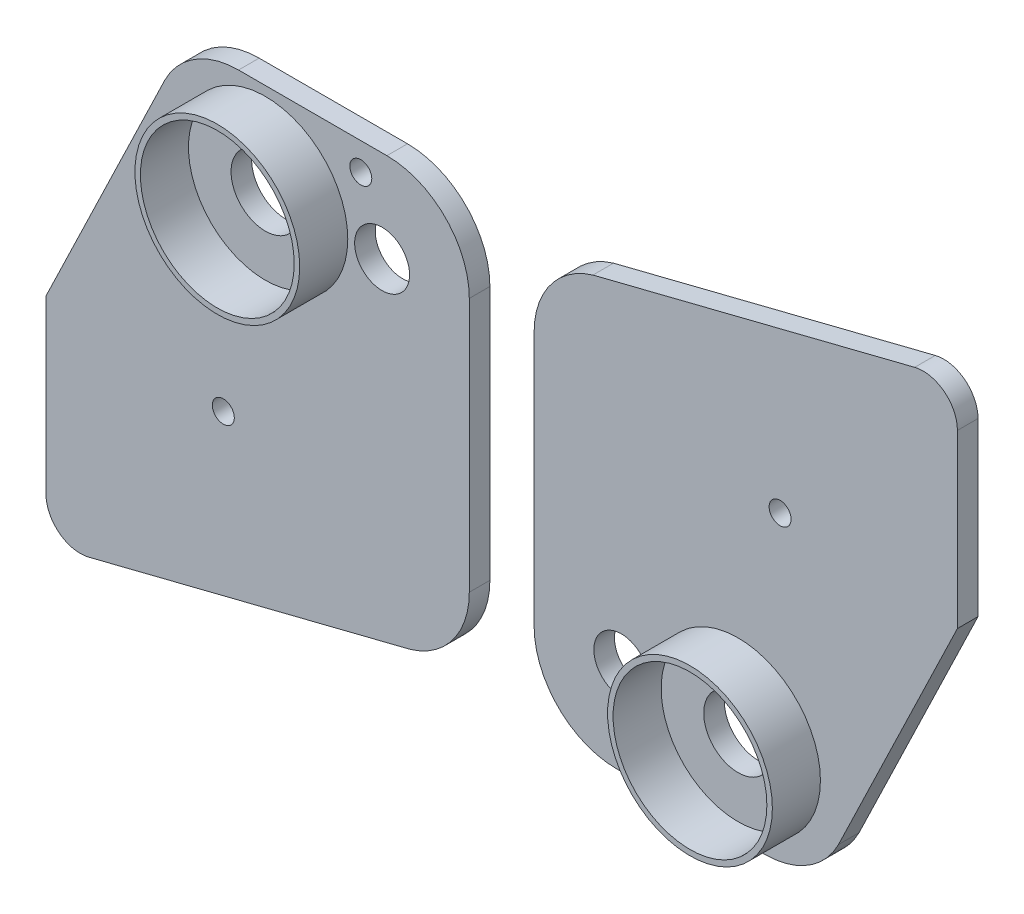
from build123d import *

# Parameters (mm, degrees)
MODEL_R                       = 5
MODEL_R_2                     = 4
MODEL_R_3                     = 1.6
Y_KSEKLIK_EKSTR_ZYON2_DEPTH   = 3
Y_KSEKLIK_EKSTR_ZYON2_2_DEPTH = 3
IZIM2_R                       = 12
IZIM2_R_2                     = 11.2
Y_KSEKLIK_EKSTR_ZYON3_DEPTH   = 7
IZIM3_R                       = 1.6
KES_EKSTR_ZYON1_DEPTH         = 7


with BuildPart() as part:
    # Model → Yükseklik-Ekstrüzyon2 (new body)
    with BuildSketch(Plane.XY):
        with BuildLine():
            Line((294.652901745, 168.135808825), (294.652403018, 143.145355564))
            ThreePointArc((294.652403018, 143.145355564), (296.578324113, 139.201902019), (300.872515341, 138.296407884))
            Line((300.872515341, 138.296407884), (347.73731009, 150.088964557))
            ThreePointArc((347.73731009, 150.088964557), (353.925243575, 154.418161808), (356.30167976, 161.586496391))
            Line((356.30167976, 161.586496391), (356.30175763, 168.122816561))
            Line((356.30175763, 168.122816561), (356.302119744, 198.648056356))
            ThreePointArc((356.302119744, 198.648056356), (352.78750447, 207.133373479), (344.302270705, 210.648191543))
            Line((344.302270705, 210.648191543), (322.694469143, 210.648448535))
            ThreePointArc((322.694469143, 210.648448535), (316.400600951, 208.865542582), (311.97699764, 204.046490372))
            Line((311.97699764, 204.046490372), (294.652901745, 168.135808825))
        make_face()
        with Locations((326.6017296, 197.277910195)):
            Circle(MODEL_R, mode=Mode.SUBTRACT)
        with Locations((343.601728105, 197.273808594)):
            Circle(MODEL_R_2, mode=Mode.SUBTRACT)
        with Locations((320.476745212, 166.47348332)):
            Circle(MODEL_R_3, mode=Mode.SUBTRACT)
    extrude(amount=Y_KSEKLIK_EKSTR_ZYON2_DEPTH)



with BuildPart() as body_2:
    # Model → Y_kseklik-Ekstr_zyon2 2 (new body)
    with BuildSketch(Plane.XY):
        with BuildLine():
            Line((421.16852996, 222.387163837), (374.304233938, 210.594732659))
            ThreePointArc((374.304233938, 210.594732659), (368.116300221, 206.265535904), (365.739863495, 199.097201598))
            Line((365.739863495, 199.097201598), (365.739824693, 195.860800514))
            Line((365.739824693, 195.860800514), (365.739785625, 192.560881428))
            Line((365.739785625, 192.560881428), (365.739423511, 162.035641633))
            ThreePointArc((365.739423511, 162.035641633), (369.254036528, 153.550317503), (377.739274869, 150.035497369))
            Line((377.739274869, 150.035497369), (399.347076431, 150.035240377))
            ThreePointArc((399.347076431, 150.035240377), (405.640945291, 151.818150271), (410.064546388, 156.637206844))
            Line((410.064546388, 156.637206844), (427.388642283, 192.547888391))
            Line((427.388642283, 192.547888391), (427.388642283, 217.538315941))
            ThreePointArc((427.388642283, 217.538315941), (425.462681839, 221.481700377), (421.16852996, 222.387163837))
        make_face()
        with Locations((395.439813655, 163.405787794)):
            Circle(MODEL_R, mode=Mode.SUBTRACT)
        with Locations((378.43981515, 163.409889395)):
            Circle(MODEL_R_2, mode=Mode.SUBTRACT)
        with Locations((401.564798043, 194.210214669)):
            Circle(MODEL_R_3, mode=Mode.SUBTRACT)
    extrude(amount=Y_KSEKLIK_EKSTR_ZYON2_2_DEPTH)


with BuildPart() as part_1:
    add(part.part)

    add(body_2.part)  # Yükseklik-Ekstrüzyon3 merges body 2
    # Çizim2 → Yükseklik-Ekstrüzyon3 (add)
    # profile 1 of 2: a face of its own
    with BuildSketch(Plane.XY.offset(3)):
        with Locations((395.439813655, 163.405787794)):
            Circle(IZIM2_R)
        with Locations((395.439813655, 163.405787794)):
            Circle(IZIM2_R_2, mode=Mode.SUBTRACT)
    # profile 2 of 2: a face of its own
    with BuildSketch(Plane.XY.offset(3)):
        with Locations((326.6017296, 197.277910195)):
            Circle(IZIM2_R)
        with Locations((326.6017296, 197.277910195)):
            Circle(IZIM2_R_2, mode=Mode.SUBTRACT)
    extrude(amount=Y_KSEKLIK_EKSTR_ZYON3_DEPTH)

    # Çizim3 → Kes-Ekstrüzyon1 (cut)
    with BuildSketch(Plane.XY.offset(3)):
        with Locations((340.498369924, 206.648236785)):
            Circle(IZIM3_R)
        with Locations((381.54317565, 154.035452128)):
            Circle(IZIM3_R)
    extrude(amount=-KES_EKSTR_ZYON1_DEPTH, mode=Mode.SUBTRACT)


solid = part_1.part
